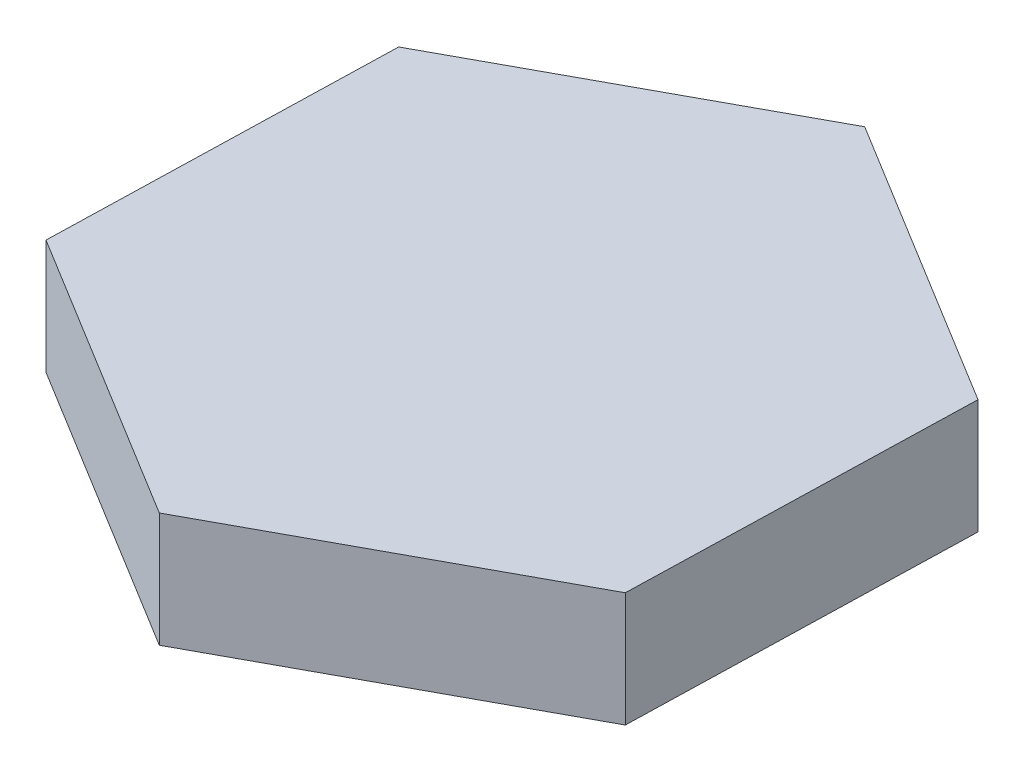
from build123d import *

# Parameters (mm, degrees)
SALIENTE_EXTRUIR1_DEPTH = 10


with BuildPart() as part:
    # Croquis1 → Saliente-Extruir1 (new body)
    with BuildSketch(Plane(origin=(0, 0, 0), x_dir=(1, 0, 0), z_dir=(0, 1, 0))):
        Polygon((0.79564839, 29.989447205), (-25.57379893, 15.683775321), (-26.36944732, -14.305671884), (-0.79564839, -29.989447205), (25.57379893, -15.683775321), (26.36944732, 14.305671884), align=None)
    extrude(amount=SALIENTE_EXTRUIR1_DEPTH)


solid = part.part
